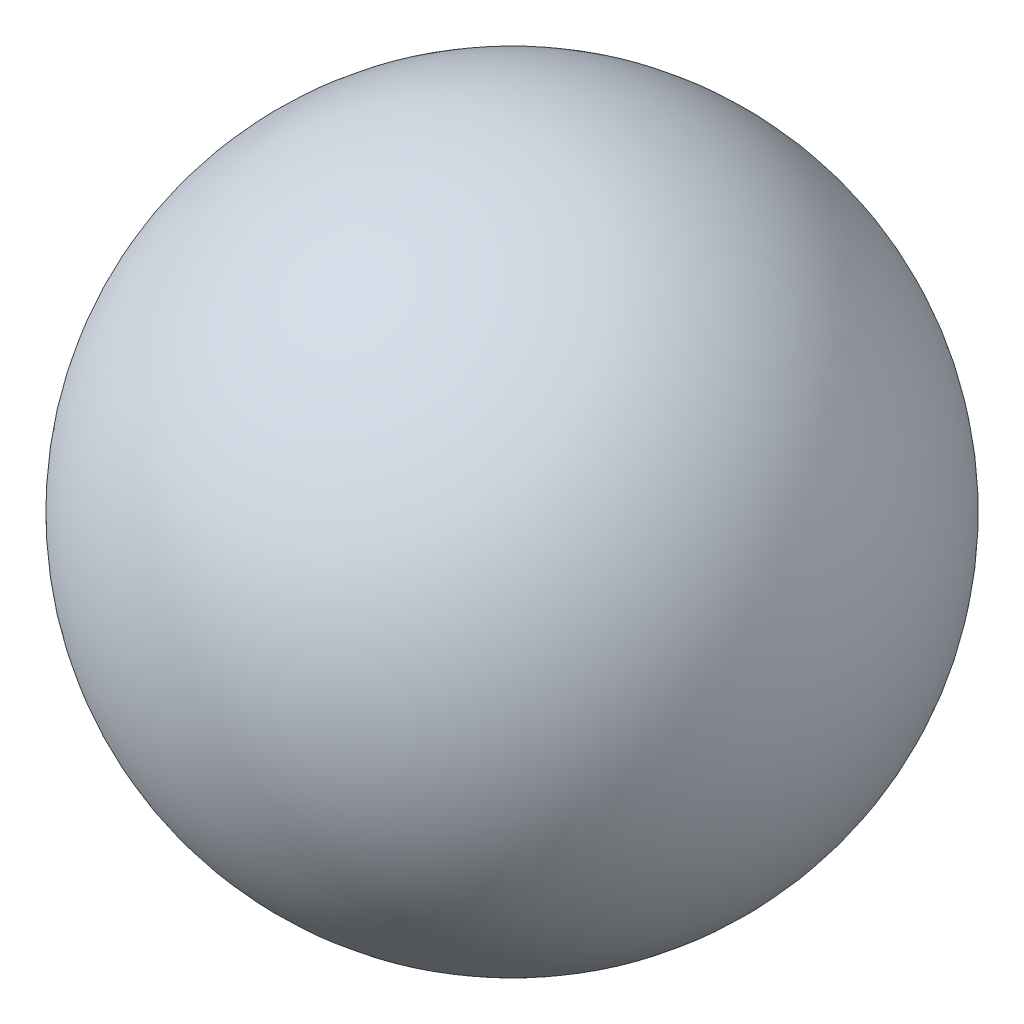
from build123d import *


with BuildPart() as part:
    # 草图1 → 旋转1 (revolve)
    with BuildSketch(Plane.XY):
        with BuildLine():
            Line((0, 128), (0, -128))
            ThreePointArc((0, -128), (-128, 0), (0, 128))
        make_face()
    revolve(axis=Axis((0, 128, 0), (0, -1, 0)))


solid = part.part
